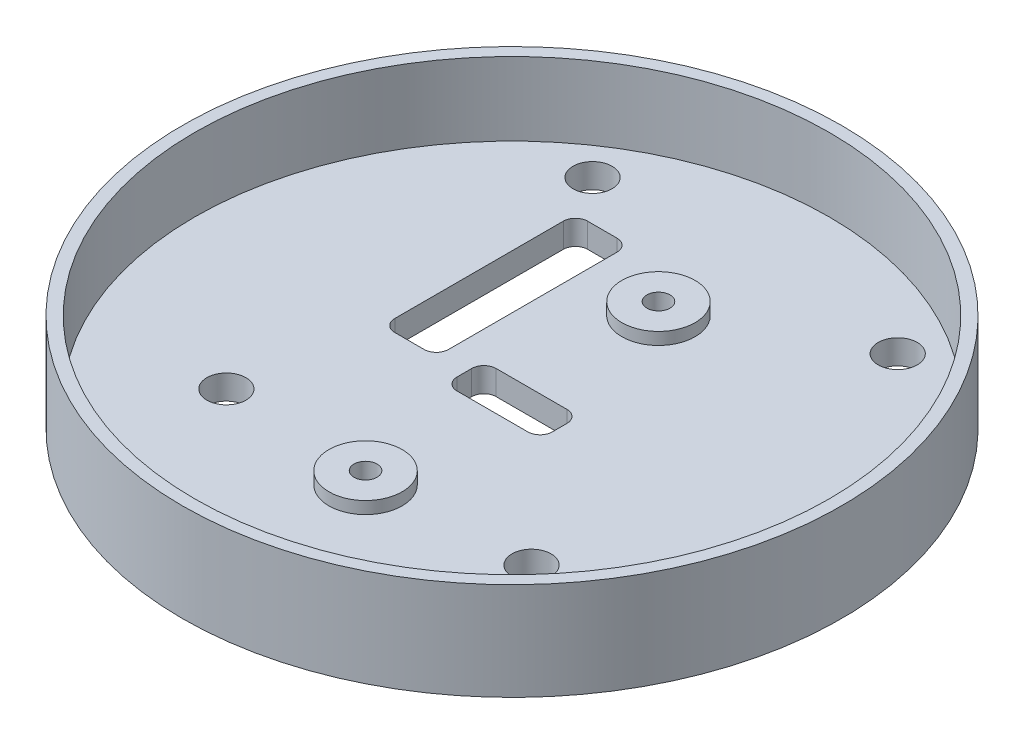
from build123d import *

# Parameters (mm, degrees)
SKETCH1_R            = 34.29
BOSS_EXTRUDE1_DEPTH  = 10.16
SKETCH2_R            = 33.02
CUT_EXTRUDE1_DEPTH   = 7.62
SKETCH3_R            = 3.81
BOSS_EXTRUDE2_DEPTH  = 1.27
CUT_EXTRUDE3_REACH   = 51.088
CUT_EXTRUDE4_REACH   = 51.088
CUT_EXTRUDE5_REACH   = 51.546
SKETCH11_R           = 2.032
M2_CLEARANCE_HOLE1_D = 2.4


with BuildPart() as part:
    # Sketch1 → Boss-Extrude1 (new body)
    with BuildSketch(Plane(origin=(0, 0, 0), x_dir=(1, 0, 0), z_dir=(0, 1, 0))):
        with Locations(Location((0, 0, 0), (0, 0, 270))):
            Circle(SKETCH1_R)
    extrude(amount=BOSS_EXTRUDE1_DEPTH)

    # Sketch2 → Cut-Extrude1 (cut)
    with BuildSketch(Plane(origin=(0, 10.16, 0), x_dir=(1, 0, 0), z_dir=(0, 1, 0))):
        with Locations(Location((0, 0, 0), (0, 0, 270))):
            Circle(SKETCH2_R)
    extrude(amount=-CUT_EXTRUDE1_DEPTH, mode=Mode.SUBTRACT)

    # Sketch3 → Boss-Extrude2 (add)
    with BuildSketch(Plane(origin=(0, 2.54, 0), x_dir=(1, 0, 0), z_dir=(0, 1, 0))):
        with Locations(Location((0, -15.24, 0), (0, 0, 270))):
            Circle(SKETCH3_R)
        with Locations(Location((0, 15.24, 0), (0, 0, 270))):
            Circle(SKETCH3_R)
    extrude(amount=BOSS_EXTRUDE2_DEPTH)

    # Sketch8 → Cut-Extrude3 (cut, up to next)
    with BuildSketch(Plane(origin=(0, 2.54, 0), x_dir=(1, 0, 0), z_dir=(0, 1, 0)), mode=Mode.PRIVATE) as cut_extrude3_sk1:
        with BuildLine():
            Line((3.683, 2.032), (-3.683, 2.032))
            ThreePointArc((-3.683, 2.032), (-4.581025612, 1.660025612), (-4.953, 0.762))
            Line((-4.953, 0.762), (-4.953, -0.762))
            ThreePointArc((-4.953, -0.762), (-4.581025612, -1.660025612), (-3.683, -2.032))
            Line((-3.683, -2.032), (3.683, -2.032))
            ThreePointArc((3.683, -2.032), (4.581025612, -1.660025612), (4.953, -0.762))
            Line((4.953, -0.762), (4.953, 0.762))
            ThreePointArc((4.953, 0.762), (4.581025612, 1.660025612), (3.683, 2.032))
        make_face()
    cut_extrude3_tool1 = extrude(cut_extrude3_sk1.sketch, amount=-CUT_EXTRUDE3_REACH, mode=Mode.PRIVATE) & part.part
    add(cut_extrude3_tool1.solids().sort_by_distance((0, 2.54, 0))[0], mode=Mode.SUBTRACT)

    # Sketch9 → Cut-Extrude4 (cut, up to next)
    with BuildSketch(Plane(origin=(0, 2.54, 0), x_dir=(1, 0, 0), z_dir=(0, 1, 0)), mode=Mode.PRIVATE) as cut_extrude4_sk1:
        with BuildLine():
            Line((-12.192, 0), (-9.144, 0))
            ThreePointArc((-9.144, 0), (-8.245974388, 0.371974388), (-7.874, 1.27))
            Line((-7.874, 1.27), (-7.874, 18.796))
            ThreePointArc((-7.874, 18.796), (-8.245974388, 19.694025612), (-9.144, 20.066))
            Line((-9.144, 20.066), (-12.192, 20.066))
            ThreePointArc((-12.192, 20.066), (-13.090025612, 19.694025612), (-13.462, 18.796))
            Line((-13.462, 18.796), (-13.462, 1.27))
            ThreePointArc((-13.462, 1.27), (-13.090025612, 0.371974388), (-12.192, 0))
        make_face()
    cut_extrude4_tool1 = extrude(cut_extrude4_sk1.sketch, amount=-CUT_EXTRUDE4_REACH, mode=Mode.PRIVATE) & part.part
    add(cut_extrude4_tool1.solids().sort_by_distance((-10.668, 2.54, -10.033))[0], mode=Mode.SUBTRACT)

    # Sketch11 → Cut-Extrude5 (cut, up to next)
    with BuildSketch(Plane.XZ, mode=Mode.PRIVATE) as cut_extrude5_sk1:
        with Locations(Location((15.875, 13.843, 0), (0, 0, 270))):
            Circle(SKETCH11_R)
    cut_extrude5_tool1 = extrude(cut_extrude5_sk1.sketch, amount=-CUT_EXTRUDE5_REACH, mode=Mode.PRIVATE) & part.part
    # Sketch11 → Cut-Extrude5 (cut, up to next)
    with BuildSketch(Plane.XZ, mode=Mode.PRIVATE) as cut_extrude5_sk2:
        with Locations(Location((-15.875, 13.843, 0), (0, 0, 270))):
            Circle(SKETCH11_R)
    cut_extrude5_tool2 = extrude(cut_extrude5_sk2.sketch, amount=-CUT_EXTRUDE5_REACH, mode=Mode.PRIVATE) & part.part
    # Sketch11 → Cut-Extrude5 (cut, up to next)
    with BuildSketch(Plane.XZ, mode=Mode.PRIVATE) as cut_extrude5_sk3:
        with Locations(Location((-15.875, -24.257, 0), (0, 0, 270))):
            Circle(SKETCH11_R)
    cut_extrude5_tool3 = extrude(cut_extrude5_sk3.sketch, amount=-CUT_EXTRUDE5_REACH, mode=Mode.PRIVATE) & part.part
    # Sketch11 → Cut-Extrude5 (cut, up to next)
    with BuildSketch(Plane.XZ, mode=Mode.PRIVATE) as cut_extrude5_sk4:
        with Locations(Location((15.875, -24.257, 0), (0, 0, 270))):
            Circle(SKETCH11_R)
    cut_extrude5_tool4 = extrude(cut_extrude5_sk4.sketch, amount=-CUT_EXTRUDE5_REACH, mode=Mode.PRIVATE) & part.part
    add(cut_extrude5_tool1.solids().sort_by_distance((15.875, 0, 13.843))[0], mode=Mode.SUBTRACT)
    add(cut_extrude5_tool2.solids().sort_by_distance((-15.875, 0, 13.843))[0], mode=Mode.SUBTRACT)
    add(cut_extrude5_tool3.solids().sort_by_distance((-15.875, 0, -24.257))[0], mode=Mode.SUBTRACT)
    add(cut_extrude5_tool4.solids().sort_by_distance((15.875, 0, -24.257))[0], mode=Mode.SUBTRACT)

    # M2 Clearance Hole1 (through all)
    with Locations(Plane(origin=(0, 3.81, 0), x_dir=(1, 0, 0), z_dir=(0, 1, 0))):
        with Locations((0, 15.24), (0, -15.24)):
            Hole(M2_CLEARANCE_HOLE1_D / 2)


solid = part.part
